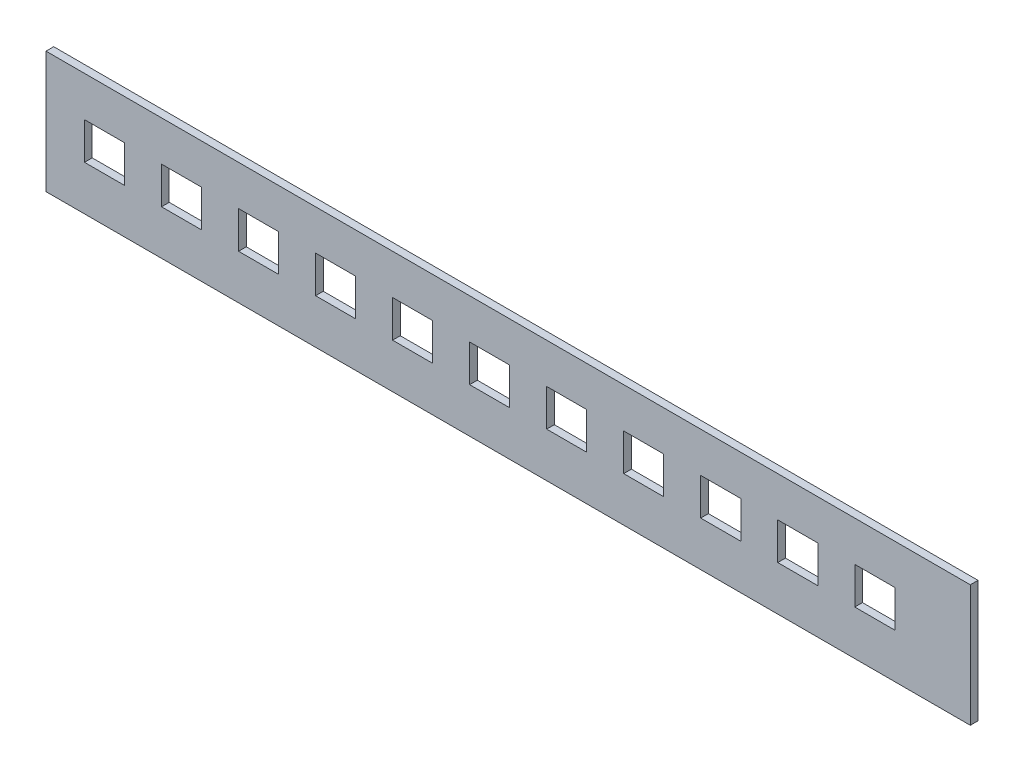
from build123d import *

# Parameters (mm, degrees)
SKETCH1_W           = 60
SKETCH1_H           = 7.9
BOSS_EXTRUDE1_DEPTH = 0.5
SKETCH2_W           = 2.6
SKETCH2_H           = 2.4
CUT_EXTRUDE1_DEPTH  = 61.519914078
LPATTERN1_COUNT     = 11
LPATTERN1_PITCH     = 5


with BuildPart() as part:
    # Sketch1 → Boss-Extrude1 (new body)
    with BuildSketch(Plane.XY):
        with Locations((30, -3.95)):
            Rectangle(SKETCH1_W, SKETCH1_H)
    extrude(amount=BOSS_EXTRUDE1_DEPTH)

    # Sketch2 → Cut-Extrude1 (cut, symmetric)
    with BuildSketch(Plane.XY.offset(0.5)):
        with Locations((3.8, -3.8)):
            Rectangle(SKETCH2_W, SKETCH2_H)
    cut_extrude1 = extrude(amount=CUT_EXTRUDE1_DEPTH, both=True, mode=Mode.SUBTRACT)

    # LPattern1: Cut-Extrude1 ×11
    with Locations(*[(i * LPATTERN1_PITCH, 0, 0) for i in range(1, LPATTERN1_COUNT)]):
        add(cut_extrude1, mode=Mode.SUBTRACT)


solid = part.part
